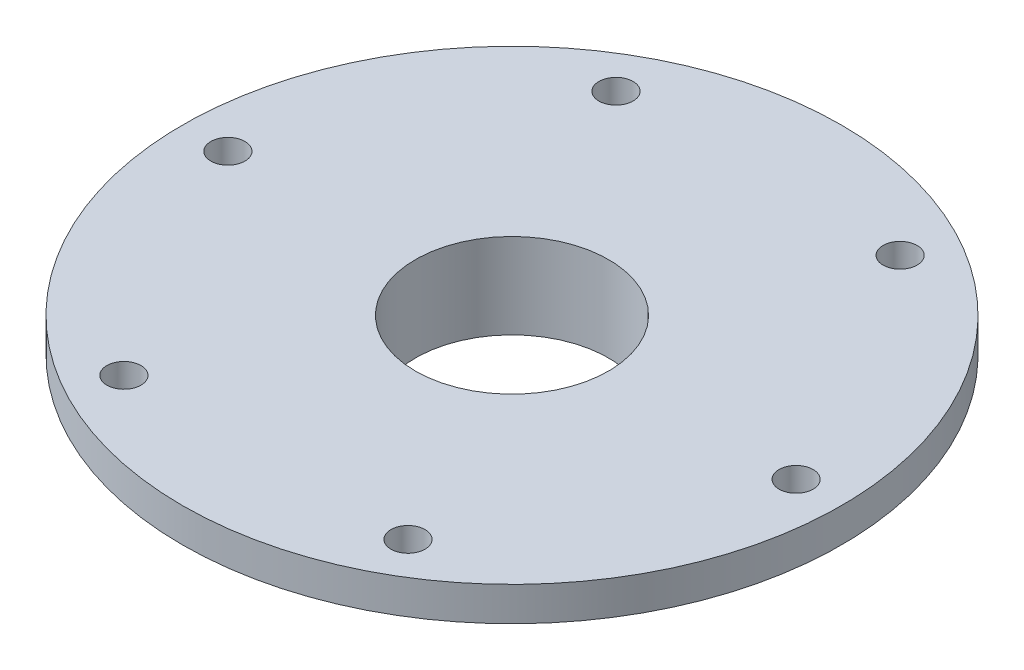
from build123d import *

# Parameters (mm, degrees)
SKETCH5_R          = 1.5
CUT_EXTRUDE1_DEPTH = 42.692325433


with BuildPart() as part:
    # Sketch4 → Revolve1 (revolve)
    with BuildSketch(Plane.XY, mode=Mode.PRIVATE) as revolve1_sk:
        Polygon((-8.5, 0), (-29, 0), (-29, -3), (-11.75, -3), (-11.75, -7.5), (-8.5, -7.5), align=None)
    revolve(revolve1_sk.sketch.rotate(Axis((0, 27.279243053, 0), (0, -1, 0)), 270), axis=Axis((0, 27.279243053, 0), (0, -1, 0)))

    # Sketch5 → Cut-Extrude1 (cut, through all)
    with BuildSketch(Plane(origin=(0, 0, 0), x_dir=(1, 0, 0), z_dir=(0, 1, 0))):
        with Locations(Location((-25, 0, 0), (0, 0, 270))):
            Circle(SKETCH5_R)
        with Locations(Location((-12.5, 21.650635095, 0), (0, 0, 270))):
            Circle(SKETCH5_R)
        with Locations(Location((12.5, 21.650635095, 0), (0, 0, 270))):
            Circle(SKETCH5_R)
        with Locations(Location((25, 0, 0), (0, 0, 270))):
            Circle(SKETCH5_R)
        with Locations(Location((12.5, -21.650635095, 0), (0, 0, 270))):
            Circle(SKETCH5_R)
        with Locations(Location((-12.5, -21.650635095, 0), (0, 0, 270))):
            Circle(SKETCH5_R)
    extrude(amount=-CUT_EXTRUDE1_DEPTH, mode=Mode.SUBTRACT)


solid = part.part
